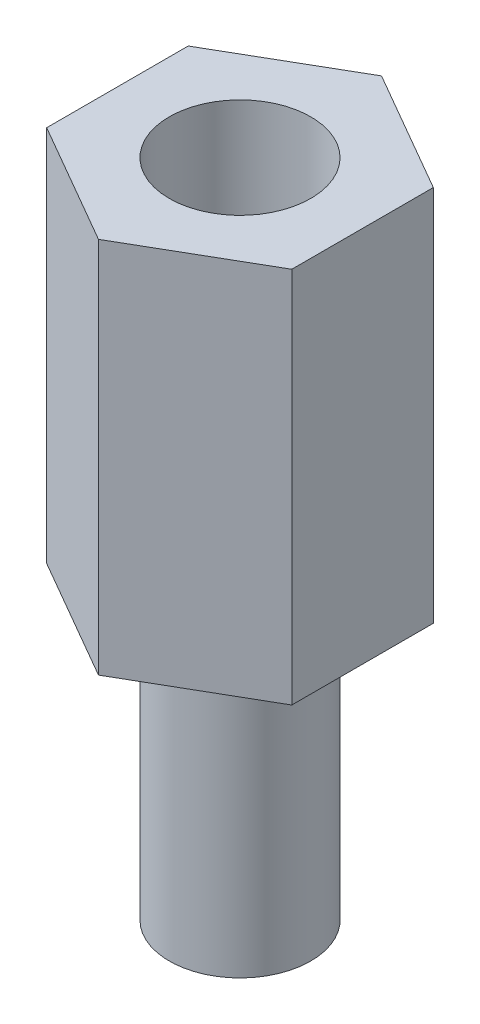
from build123d import *

# Parameters (mm, degrees)
SALIENTE_EXTRUIR1_DEPTH = 8
CROQUIS2_R              = 1.5
SALIENTE_EXTRUIR2_DEPTH = 6
CROQUIS3_R              = 1.5
CORTAR_EXTRUIR1_DEPTH   = 6


with BuildPart() as part:
    # Croquis1 → Saliente-Extruir1 (new body)
    with BuildSketch(Plane(origin=(0, 0, 0), x_dir=(1, 0, 0), z_dir=(0, 1, 0))):
        Polygon((-2.598076211, 1.5), (-2.598076211, -1.5), (0, -3), (2.598076211, -1.5), (2.598076211, 1.5), (0, 3), align=None)
    extrude(amount=SALIENTE_EXTRUIR1_DEPTH)

    # Croquis2 → Saliente-Extruir2 (add)
    with BuildSketch(Plane.XZ):
        with Locations(Location((0, 0, 0), (0, 0, 270))):
            Circle(CROQUIS2_R)
    extrude(amount=SALIENTE_EXTRUIR2_DEPTH)

    # Croquis3 → Cortar-Extruir1 (cut)
    with BuildSketch(Plane(origin=(0, 8, 0), x_dir=(1, 0, 0), z_dir=(0, 1, 0))):
        with Locations(Location((0, 0, 0), (0, 0, 90))):
            Circle(CROQUIS3_R)
    extrude(amount=-CORTAR_EXTRUIR1_DEPTH, mode=Mode.SUBTRACT)


solid = part.part
